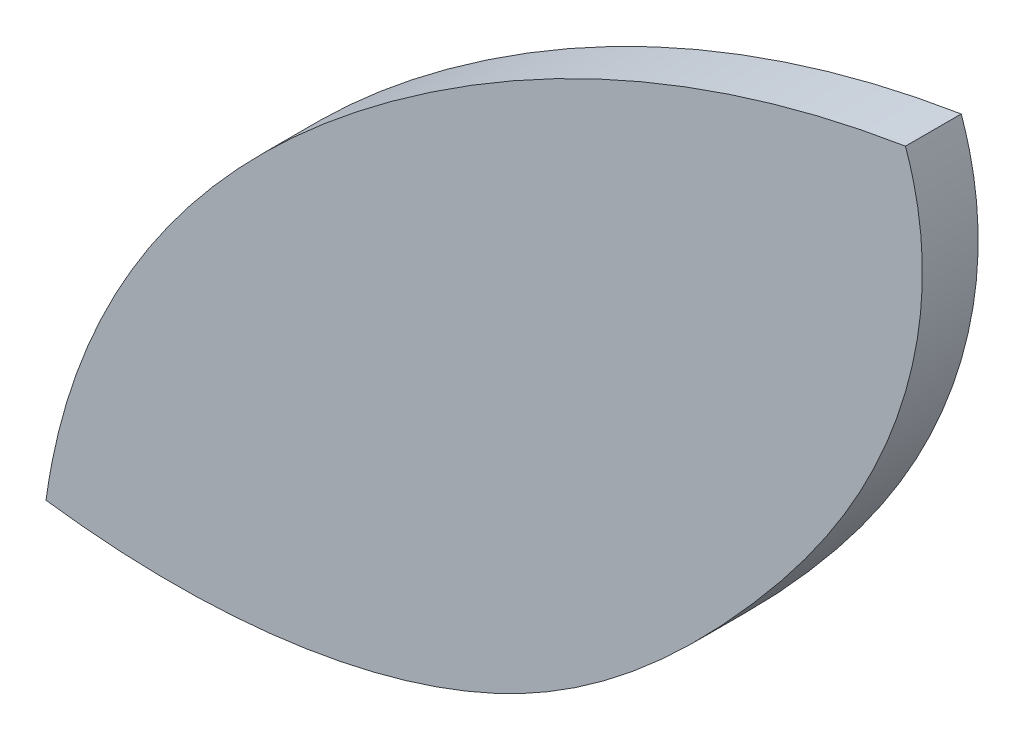
from build123d import *

# Parameters (mm, degrees)
ESTRUSIONE_ESTRUSIONE1_DEPTH = 3


with BuildPart() as part:
    # Schizzo1 → Estrusione-Estrusione1 (new body)
    with BuildSketch(Plane.XY):
        with BuildLine():
            add(Edge.make_bspline(
                [(0, 0), (1.643549729, 12.058024316), (16.325094641, 29.415995083), (36.577725796, 38.055463823), (46.226454712, 39.606646877)],
                knots=[0, 0, 0, 0, 0.544922034, 1, 1, 1, 1], degree=3))
            add(Edge.make_bspline(
                [(46.226454712, 39.606646877), (47.934931795, 34.847822294), (46.253893396, 24.796684219), (37.643834367, 13.058756394), (23.750650185, 0.330471541), (8.689502399, -1.183621912), (0, 0)],
                knots=[0, 0, 0, 0, 0.211913715, 0.407861761, 0.61661294, 1, 1, 1, 1], degree=3))
        make_face()
    extrude(amount=ESTRUSIONE_ESTRUSIONE1_DEPTH)


solid = part.part
